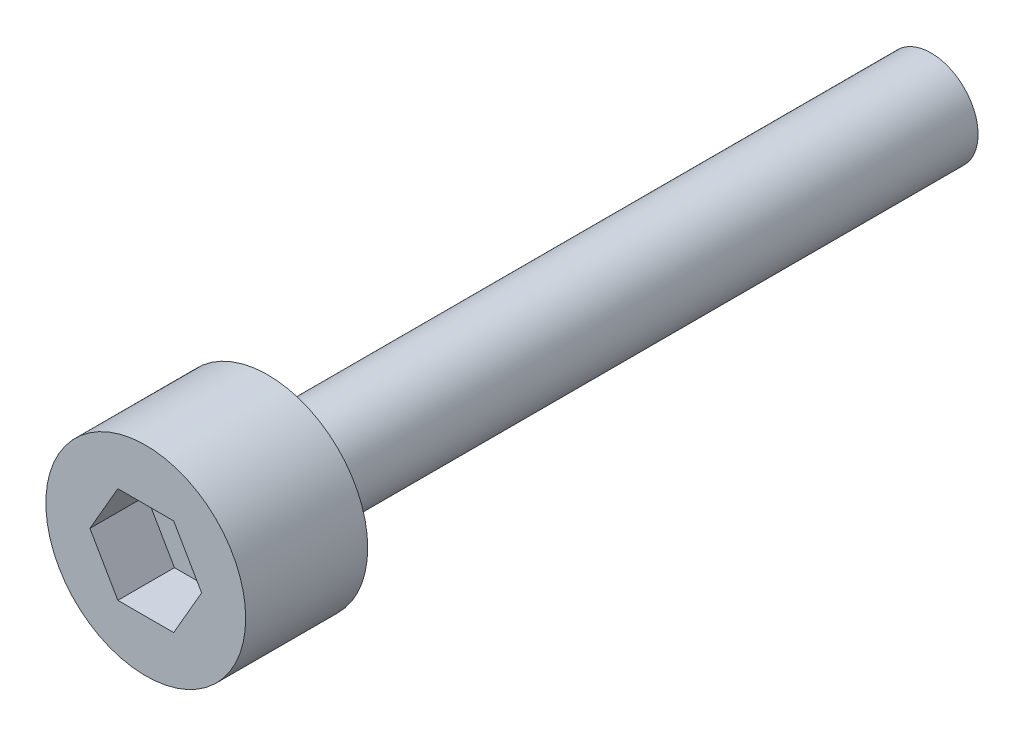
from build123d import *

# Parameters (mm, degrees)
SKETCH1_R           = 2.8702
BOSS_EXTRUDE1_DEPTH = 3.5052
SKETCH2_R           = 1.7526
BOSS_EXTRUDE2_DEPTH = 19.05
SKETCH3_OUTSIDE_W   = 12.534
SKETCH3_OUTSIDE_H   = 12.534
SKETCH3_OUTSIDE_R   = 1.35255
CUT_EXTRUDE1_DEPTH  = 19.05
CUT_EXTRUDE2_DEPTH  = 1.6256


with BuildPart() as part:
    # Sketch1 → Boss-Extrude1 (new body)
    with BuildSketch(Plane.XY):
        Circle(SKETCH1_R)
    extrude(amount=BOSS_EXTRUDE1_DEPTH)

    # Sketch2 → Boss-Extrude2 (add)
    with BuildSketch(Plane(origin=(0, 0, 0), x_dir=(-1, 0, 0), z_dir=(0, 0, -1))):
        Circle(SKETCH2_R)
    extrude(amount=BOSS_EXTRUDE2_DEPTH)

    # Sketch3 outside → Cut-Extrude1 (cut)
    with BuildSketch(Plane(origin=(0, 0, -19.05), x_dir=(-1, 0, 0), z_dir=(0, 0, -1))):
        Rectangle(SKETCH3_OUTSIDE_W, SKETCH3_OUTSIDE_H)
        Circle(SKETCH3_OUTSIDE_R, mode=Mode.SUBTRACT)
    extrude(amount=-CUT_EXTRUDE1_DEPTH, mode=Mode.SUBTRACT)

    # Sketch4 → Cut-Extrude2 (cut)
    with BuildSketch(Plane.XY.offset(3.5052)):
        Polygon((0.801975608, 1.3890625), (-0.801975608, 1.3890625), (-1.603951217, 0), (-0.801975608, -1.3890625), (0.801975608, -1.3890625), (1.603951217, 0), align=None)
    extrude(amount=-CUT_EXTRUDE2_DEPTH, mode=Mode.SUBTRACT)


solid = part.part
